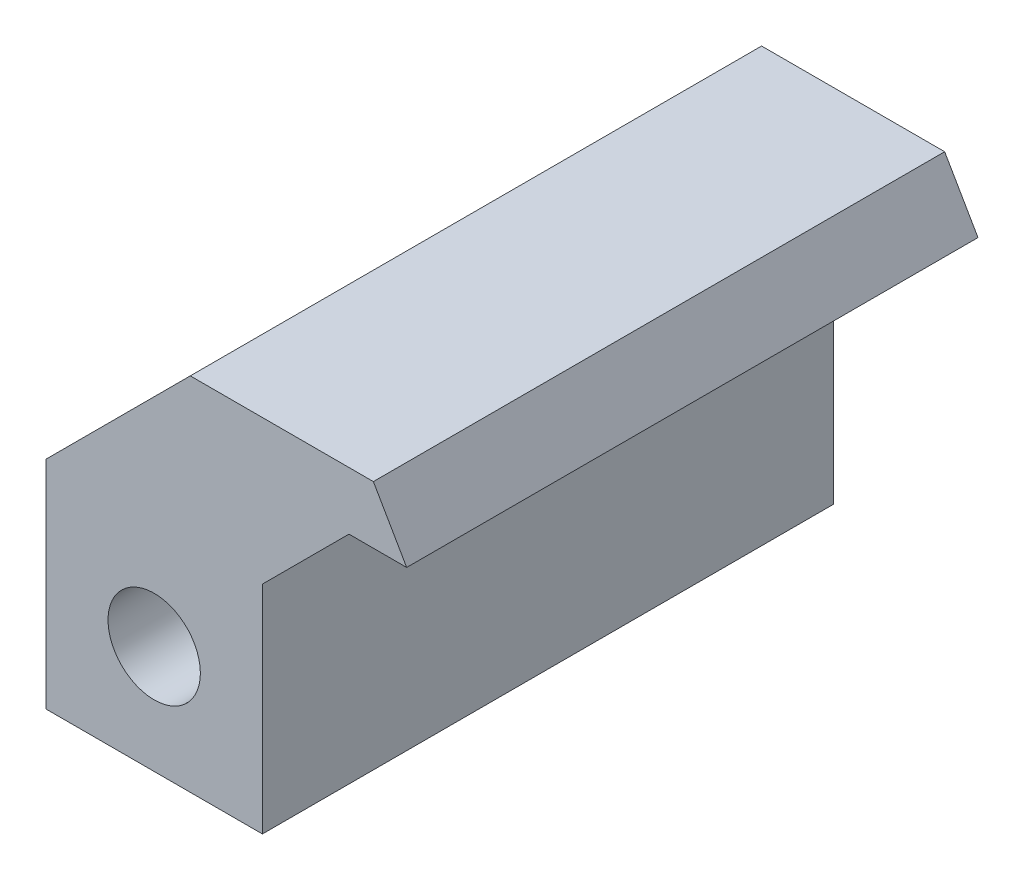
from build123d import *

# Parameters (mm, degrees)
BOSS_EXTRUDE1_DEPTH      = 9.9
BOSS_EXTRUDE1_DEPTH_BACK = 9.9
SKETCH1_W                = 7.5
SKETCH1_H                = 7.5
SKETCH1_R                = 1.6
BOSS_EXTRUDE2_DEPTH      = 19.8


with BuildPart() as part:
    # Sketch1 → Boss-Extrude1 (new, two sides: drawn at the far end of the back side and taken through both)
    with BuildSketch(Plane.XY.offset(-BOSS_EXTRUDE1_DEPTH_BACK)):
        Rectangle(SKETCH1_W, SKETCH1_H)
        Circle(SKETCH1_R, mode=Mode.SUBTRACT)
    extrude(amount=BOSS_EXTRUDE1_DEPTH + BOSS_EXTRUDE1_DEPTH_BACK)

    # Sketch2 → Boss-Extrude2 (add)
    with BuildSketch(Plane.XY.offset(9.9)):
        Polygon((3.75, 3.75), (6.75, 6.75), (8.75, 6.75), (7.595299462, 8.75), (1.25, 8.75), (-3.75, 3.75), align=None)
    extrude(amount=-BOSS_EXTRUDE2_DEPTH)


solid = part.part
